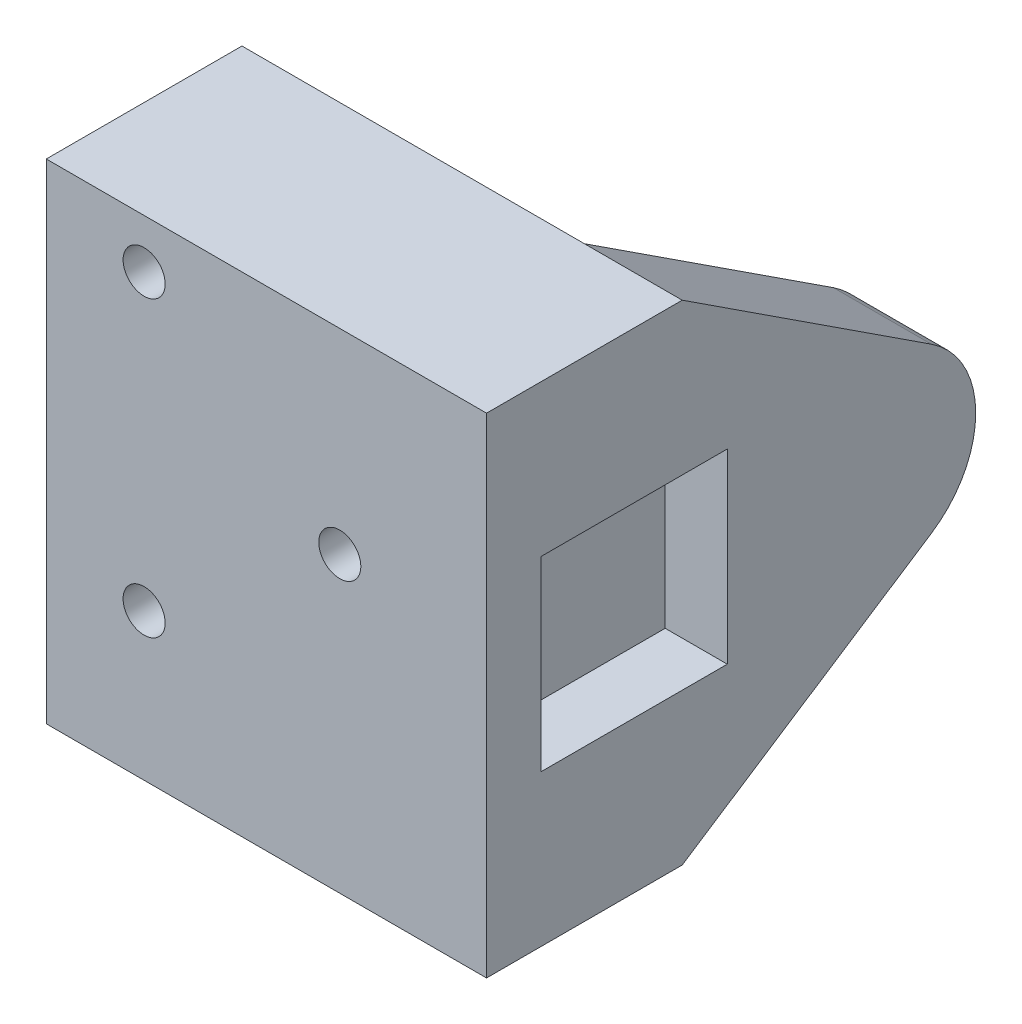
from build123d import *

# Parameters (mm, degrees)
SKETCH1_W            = 20
SKETCH1_H            = 50
BOSS_EXTRUDE1_DEPTH  = 10
SKETCH5_W            = 19.05
SKETCH5_H            = 19.05
CUT_EXTRUDE1_DEPTH   = 6.35
SKETCH7_W            = 20
SKETCH7_H            = 50
BOSS_EXTRUDE2_DEPTH  = 35
M4_CLEARANCE_HOLE1_D = 4.3


with BuildPart() as part:
    # Sketch1 → Boss-Extrude1 (new body)
    with BuildSketch(Plane(origin=(0, 0, 0), x_dir=(0, 0, -1), z_dir=(1, 0, 0))):
        with Locations((-10, 0)):
            Rectangle(SKETCH1_W, SKETCH1_H)
        with BuildLine():
            ThreePointArc((25.466783574, 8.373426859), (30, 0), (25.466783574, -8.373426859))
            Line((25.466783574, -8.373426859), (0, -25))
            Line((0, -25), (0, 25))
            Line((0, 25), (25.466783574, 8.373426859))
        make_face()
    extrude(amount=BOSS_EXTRUDE1_DEPTH)

    # Sketch5 → Cut-Extrude1 (cut)
    with BuildSketch(Plane(origin=(10, 0, 0), x_dir=(0, 0, -1), z_dir=(1, 0, 0))):
        with Locations((-4.915565879, 0)):
            Rectangle(SKETCH5_W, SKETCH5_H)
    extrude(amount=-CUT_EXTRUDE1_DEPTH, mode=Mode.SUBTRACT)

    # Sketch7 → Boss-Extrude2 (add)
    with BuildSketch(Plane.ZY):
        with Locations((10, 0)):
            Rectangle(SKETCH7_W, SKETCH7_H)
    extrude(amount=BOSS_EXTRUDE2_DEPTH)

    # M4 Clearance Hole1 (through all)
    with Locations(Plane.XY.offset(20)):
        with Locations((-25, 20), (-25, -10), (-5, 5)):
            Hole(M4_CLEARANCE_HOLE1_D / 2)


solid = part.part
